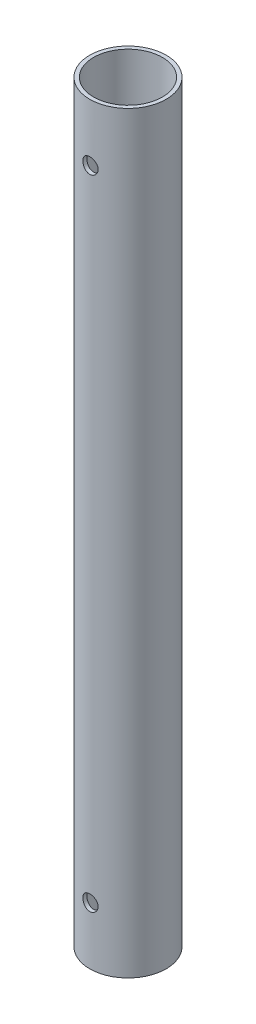
from build123d import *

# Parameters (mm, degrees)
CROQUIS1_R                 = 10
CROQUIS1_R_2               = 9
SALIENTE_EXTRUIR1_DEPTH    = 98.5
CORTAR_EXTRUIR1_DEPTH      = 100.510049744
CORTAR_EXTRUIR1_DEPTH_BACK = 100.510049744
CROQUIS2_R                 = 2


with BuildPart() as part:
    # Croquis1 → Saliente-Extruir1 (new, symmetric)
    with BuildSketch(Plane(origin=(0, 0, 0), x_dir=(1, 0, 0), z_dir=(0, 1, 0))):
        with Locations(Location((0, 0, 0), (0, 0, 270))):
            Circle(CROQUIS1_R)
        with Locations(Location((0, 0, 0), (0, 0, 270))):
            Circle(CROQUIS1_R_2, mode=Mode.SUBTRACT)
    extrude(amount=SALIENTE_EXTRUIR1_DEPTH, both=True)

    # Croquis2 → Cortar-Extruir1 (cut, two sides: drawn at the far end of the back side and taken through both)
    with BuildSketch(Plane.XY.offset(-CORTAR_EXTRUIR1_DEPTH_BACK)):
        with Locations((0, -83.5)):
            Circle(CROQUIS2_R)
        with Locations((0, 83.5)):
            Circle(CROQUIS2_R)
    extrude(amount=CORTAR_EXTRUIR1_DEPTH + CORTAR_EXTRUIR1_DEPTH_BACK, mode=Mode.SUBTRACT)


solid = part.part
